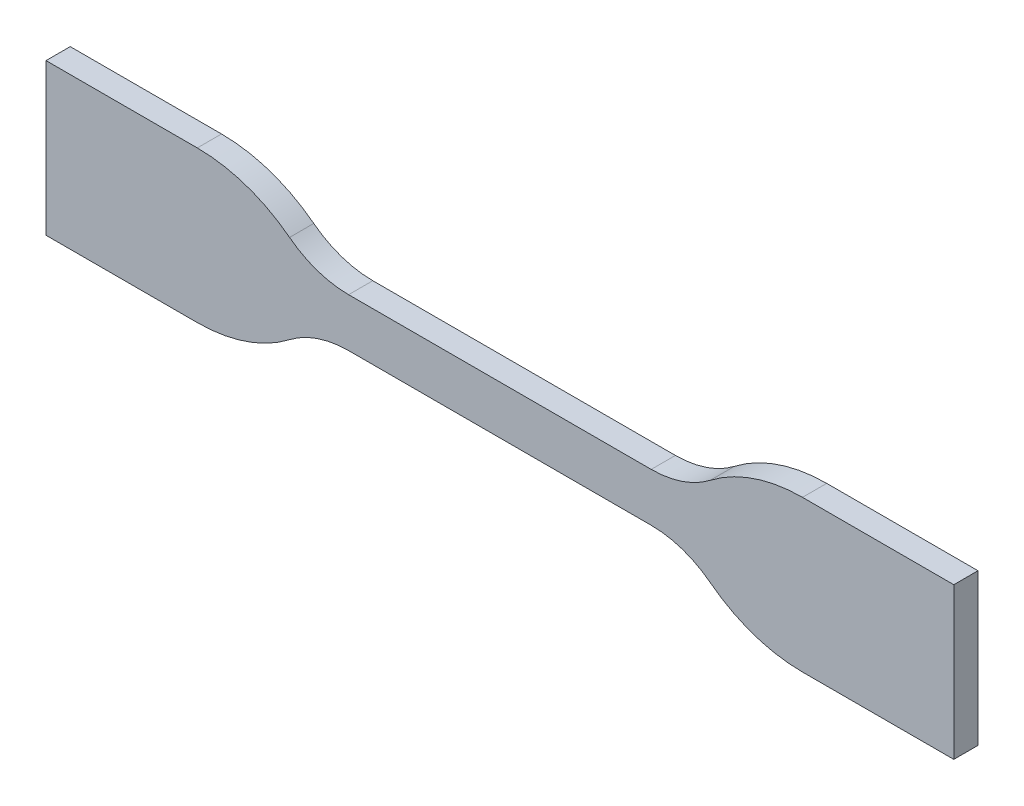
from build123d import *

# Parameters (mm, degrees)
BOSS_EXTRUDE1_DEPTH = 2


with BuildPart() as part:
    # Sketch1 → Boss-Extrude1 (new body)
    with BuildSketch(Plane.XY):
        with BuildLine():
            Line((-12.5, 2), (12.5, 2))
            ThreePointArc((12.5, 2), (15.076301187, 2.425996509), (17.378343492, 3.658636787))
            ThreePointArc((17.378343492, 3.658636787), (20.974928224, 5.584446401), (25, 6.25))
            Line((25, 6.25), (37.5, 6.25))
            Line((37.5, 6.25), (37.5, -6.25))
            Line((37.5, -6.25), (25, -6.25))
            ThreePointArc((25, -6.25), (20.974928224, -5.584446401), (17.378343492, -3.658636787))
            ThreePointArc((17.378343492, -3.658636787), (15.076301187, -2.425996509), (12.5, -2))
            Line((12.5, -2), (-12.5, -2))
            ThreePointArc((-12.5, -2), (-15.076301187, -2.425996509), (-17.378343492, -3.658636787))
            ThreePointArc((-17.378343492, -3.658636787), (-20.974928224, -5.584446401), (-25, -6.25))
            Line((-25, -6.25), (-37.5, -6.25))
            Line((-37.5, -6.25), (-37.5, 6.25))
            Line((-37.5, 6.25), (-25, 6.25))
            ThreePointArc((-25, 6.25), (-20.974928224, 5.584446401), (-17.378343492, 3.658636787))
            ThreePointArc((-17.378343492, 3.658636787), (-15.076301187, 2.425996509), (-12.5, 2))
        make_face()
    extrude(amount=BOSS_EXTRUDE1_DEPTH)


solid = part.part
